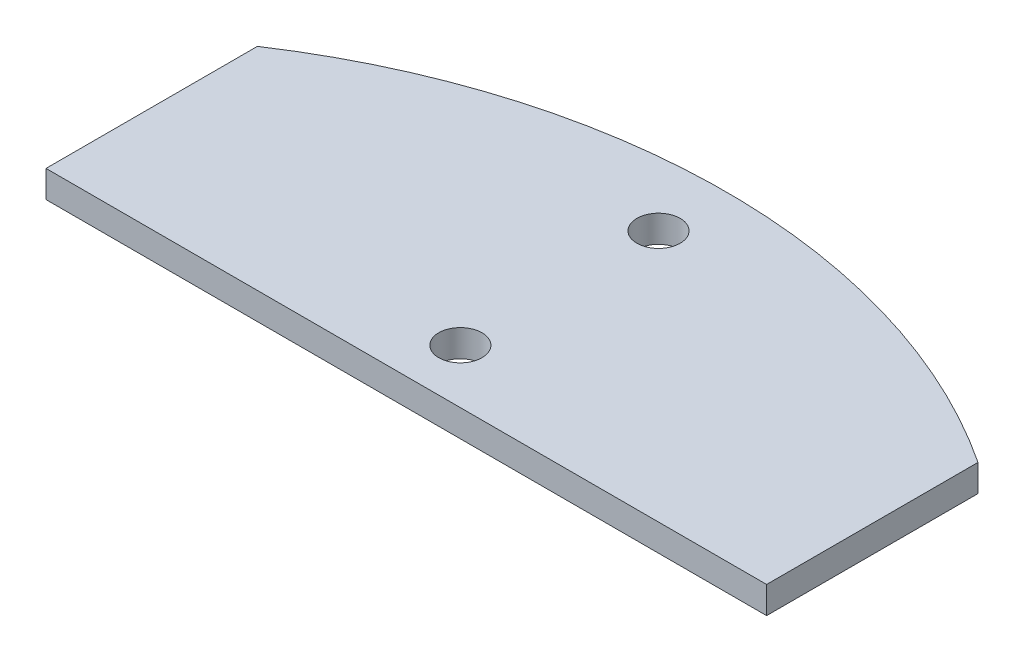
from build123d import *

# Parameters (mm, degrees)
BOSS_EXTRUDE1_DEPTH  = 3
SKETCH11_OUTSIDE_W   = 186.736
SKETCH11_OUTSIDE_H   = 177.534
SKETCH11_OUTSIDE_W_2 = 80
SKETCH11_OUTSIDE_H_2 = 40
CUT_EXTRUDE13_DEPTH  = 103.574363269
SKETCH12_R           = 2.4
CUT_EXTRUDE15_DEPTH  = 83.856804186


with BuildPart() as part:
    # Sketch1 → Boss-Extrude1 (new body)
    with BuildSketch(Plane(origin=(0, 0, 0), x_dir=(1, 0, 0), z_dir=(0, 1, 0))):
        with BuildLine():
            ThreePointArc((36.543377003, -62.616544118), (0, 72.5), (-36.543377003, -62.616544118))
            ThreePointArc((-36.543377003, -62.616544118), (-33.085954668, -63.20954405), (-30.089832649, -61.38507948))
            ThreePointArc((-30.089832649, -61.38507948), (0, -46.75), (30.089832649, -61.38507948))
            ThreePointArc((30.089832649, -61.38507948), (33.085954668, -63.20954405), (36.543377003, -62.616544118))
        make_face()
    extrude(amount=BOSS_EXTRUDE1_DEPTH)

    # Sketch11 outside → Cut-Extrude13 (cut, through all)
    with BuildSketch(Plane.XZ):
        with Locations((0, -4.601)):
            Rectangle(SKETCH11_OUTSIDE_W, SKETCH11_OUTSIDE_H)
        with Locations((0, -57)):
            Rectangle(SKETCH11_OUTSIDE_W_2, SKETCH11_OUTSIDE_H_2, mode=Mode.SUBTRACT)
    extrude(amount=-CUT_EXTRUDE13_DEPTH, mode=Mode.SUBTRACT)

    # Sketch12 → Cut-Extrude15 (cut, through all)
    with BuildSketch(Plane.XZ):
        with Locations(Location((0, -65, 0), (0, 0, 270))):
            Circle(SKETCH12_R)
        with Locations(Location((0, -43, 0), (0, 0, 270))):
            Circle(SKETCH12_R)
    extrude(amount=-CUT_EXTRUDE15_DEPTH, mode=Mode.SUBTRACT)


solid = part.part
